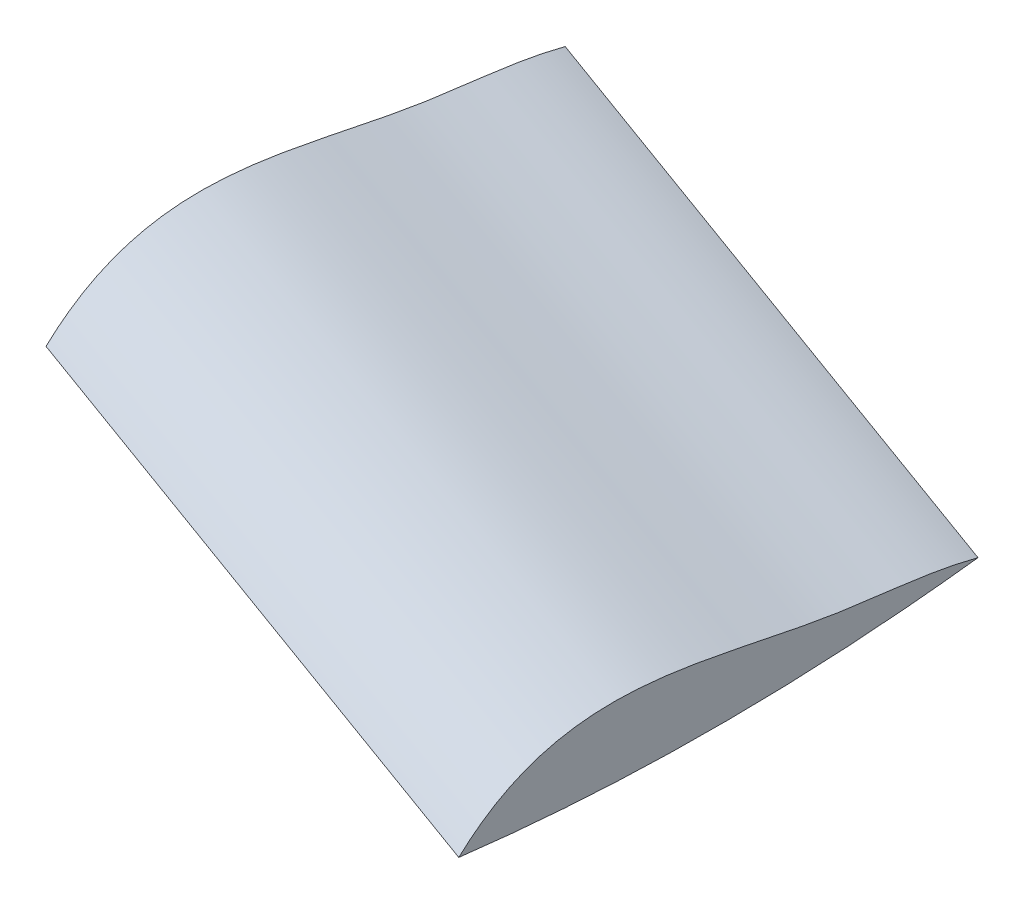
from build123d import *


with BuildPart() as part:
    # Sweep1: sweep along a path in Sketch2
    with BuildLine(Plane(origin=(0, 0, 0), x_dir=(1, 0, 0), z_dir=(0, 1, 0))) as sweep1_path:
        Line((0, -185.596834495), (-635, 45.524264264))
    # Sketch1 → Sweep1 (sweep)
    with BuildSketch(Plane(origin=(0, 0, 0), x_dir=(0, 0, -1), z_dir=(1, 0, 0))):
        with BuildLine():
            add(Edge.make_bspline(
                [(-43.700976459, -3.675096456), (60.093960524, 93.557671037), (246.664616316, 18.259692077), (417.699427231, 8.740783901), (464.299023541, -3.675096456)],
                knots=[0, 0, 0, 0, 0.726776815, 1, 1, 1, 1], degree=3))
            add(Edge.make_bspline(
                [(-43.700976459, -3.675096456), (209.422998909, -34.32642273), (464.299023541, -3.675096456)],
                knots=[0, 0, 0, 1, 1, 1], degree=2))
        make_face()
    sweep(path=sweep1_path.line)


solid = part.part
